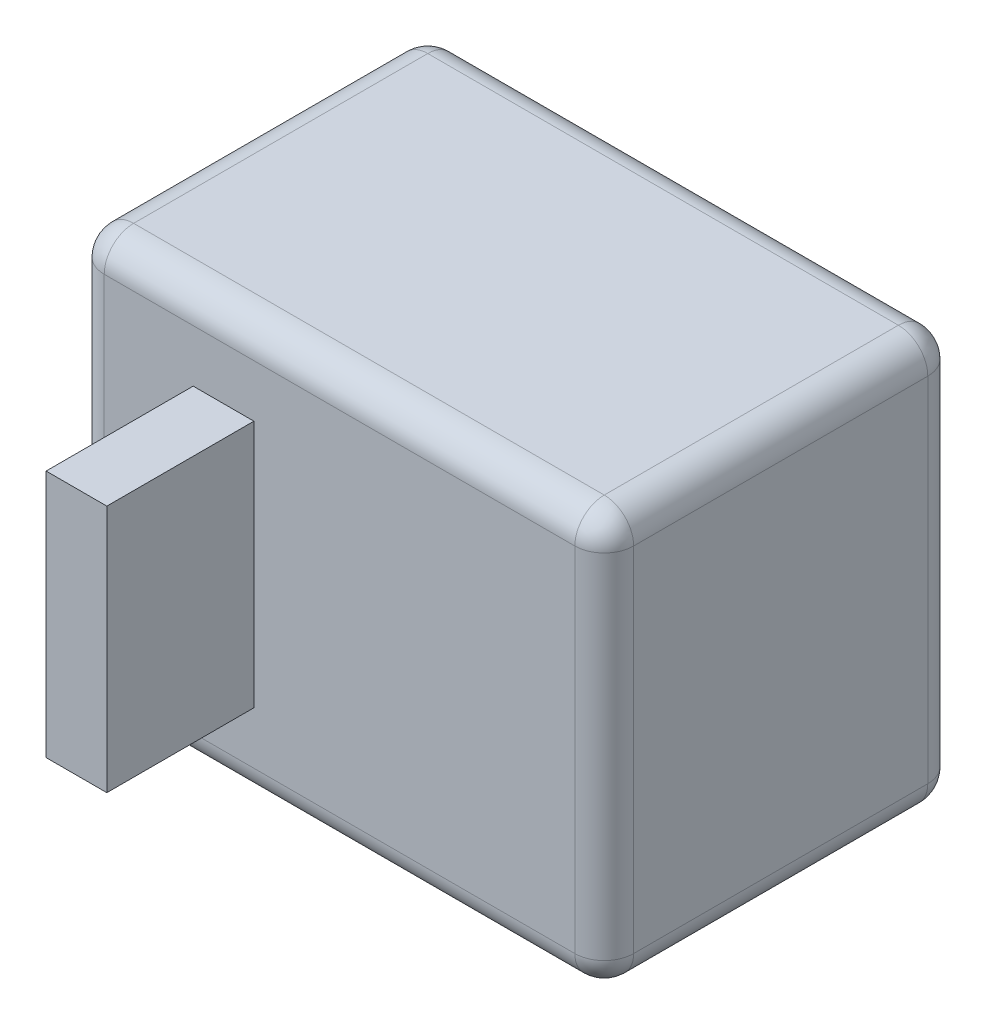
from build123d import *

# Parameters (mm, degrees)
SKETCH_1_W      = 18
SKETCH_1_H      = 14
EXTRUDE_1_DEPTH = 12
SKETCH_2_W      = 2.064874792
SKETCH_2_H      = 8.438190256
EXTRUDE_2_DEPTH = 5
FILLET_1_R      = 1


with BuildPart() as part:
    # Эскиз1 → Бобышка-Вытянуть1 (new body)
    with BuildSketch(Plane.XY):
        Rectangle(SKETCH_1_W, SKETCH_1_H)
    extrude(amount=EXTRUDE_1_DEPTH)

    # Эскиз2 → Бобышка-Вытянуть2 (add)
    with BuildSketch(Plane.XY.offset(12)):
        with Locations((-3.943253735, 0)):
            Rectangle(SKETCH_2_W, SKETCH_2_H)
    extrude(amount=EXTRUDE_2_DEPTH)

    # Скругление1
    fillet_1_edges = [part.edges().sort_by_distance(p)[0] for p in [
        (-9, 0, 12),
        (0, -7, 12),
        (9, 0, 12),
        (0, -7, 0),
        (-9, 0, 0),
        (0, 7, 0),
        (9, 0, 0),
        (0, 7, 12),
        (9, -7, 6),
        (-9, -7, 6),
        (-9, 7, 6),
        (9, 7, 6),
    ]]
    fillet(fillet_1_edges, radius=FILLET_1_R)


solid = part.part
